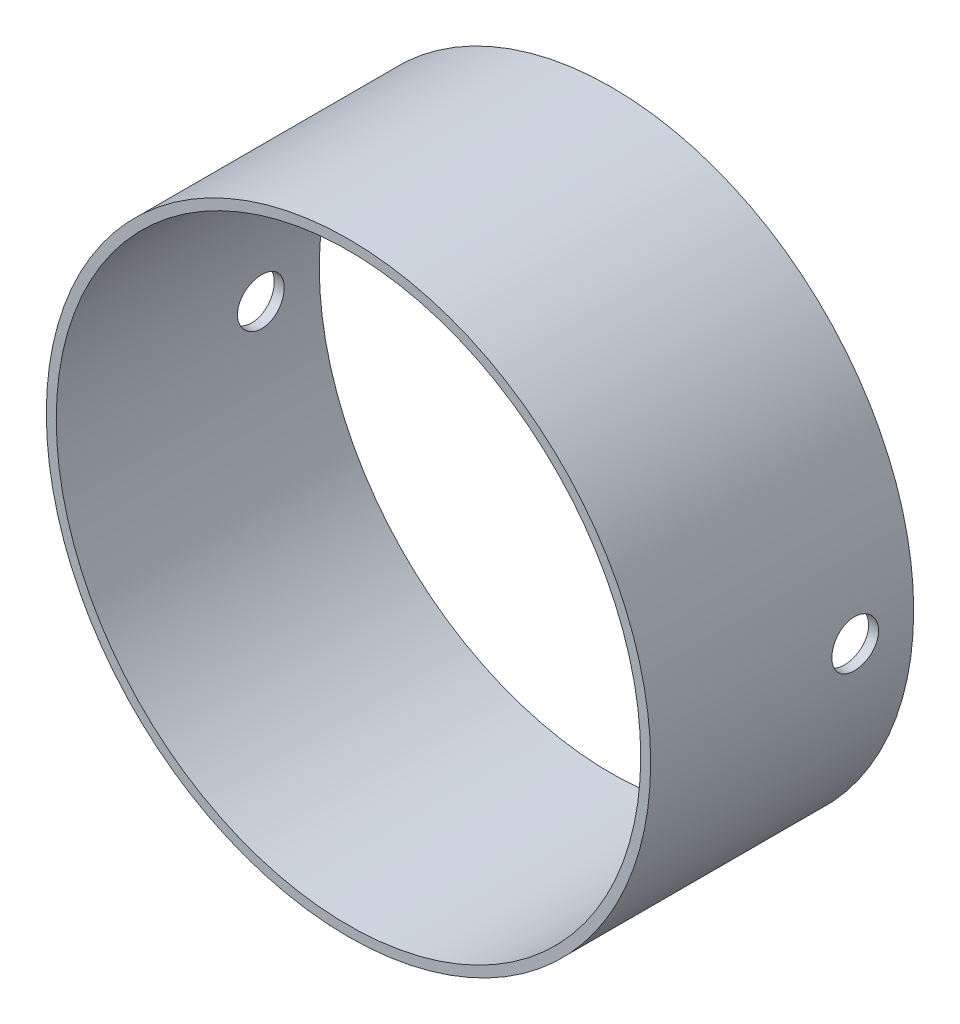
from build123d import *

# Parameters (mm, degrees)
BOSS_EXTRUDE1_DEPTH                 = 35
BOSS_EXTRUDE1_DEPTH_BACK            = 10
SKETCH1_R                           = 51.7
SKETCH1_R_2                         = 50
CUT_EXTRUDE1_REACH                  = 83.06
CUT_EXTRUDE1_END_RADIUS             = 51.7
SKETCH2_R                           = 4
CUT_EXTRUDE1_DIRECTION_2_REACH      = 83.06
CUT_EXTRUDE1_DIRECTION_2_END_RADIUS = 51.7


with BuildPart() as part:
    # Sketch1 → Boss-Extrude1 (new, two sides: drawn at the far end of the back side and taken through both)
    with BuildSketch(Plane.XY.offset(-BOSS_EXTRUDE1_DEPTH_BACK)):
        Circle(SKETCH1_R)
        Circle(SKETCH1_R_2, mode=Mode.SUBTRACT)
    extrude(amount=BOSS_EXTRUDE1_DEPTH + BOSS_EXTRUDE1_DEPTH_BACK)

    # Cut-Extrude1: up to this cylinder (the profile starts inside it)
    cut_extrude1_end = Plane(origin=(0, 0, 0), z_dir=(0, 0, 1)) * Cylinder(CUT_EXTRUDE1_END_RADIUS, 270.52, mode=Mode.PRIVATE)
    # Sketch2 → Cut-Extrude1 (cut, up to the surface)
    with BuildSketch(Plane(origin=(0, 0, 0), x_dir=(0, 0, -1), z_dir=(1, 0, 0)), mode=Mode.PRIVATE) as cut_extrude1_sk1:
        Circle(SKETCH2_R)
    cut_extrude1_tool1 = extrude(cut_extrude1_sk1.sketch, amount=-CUT_EXTRUDE1_REACH, mode=Mode.PRIVATE) & cut_extrude1_end
    add(cut_extrude1_tool1.solids().sort_by_distance((0, 0, 0))[0], mode=Mode.SUBTRACT)

    # Cut-Extrude1 direction 2: up to this cylinder (the profile starts inside it)
    cut_extrude1_direction_2_end = Plane(origin=(0, 0, 0), z_dir=(0, 0, 1)) * Cylinder(CUT_EXTRUDE1_DIRECTION_2_END_RADIUS, 270.52, mode=Mode.PRIVATE)
    # Sketch2 → Cut-Extrude1 direction 2 (cut, up to the surface)
    with BuildSketch(Plane(origin=(0, 0, 0), x_dir=(0, 0, -1), z_dir=(1, 0, 0)), mode=Mode.PRIVATE) as cut_extrude1_direction_2_sk1:
        Circle(SKETCH2_R)
    cut_extrude1_direction_2_tool1 = extrude(cut_extrude1_direction_2_sk1.sketch, amount=CUT_EXTRUDE1_DIRECTION_2_REACH, mode=Mode.PRIVATE) & cut_extrude1_direction_2_end
    add(cut_extrude1_direction_2_tool1.solids().sort_by_distance((0, 0, 0))[0], mode=Mode.SUBTRACT)


solid = part.part
